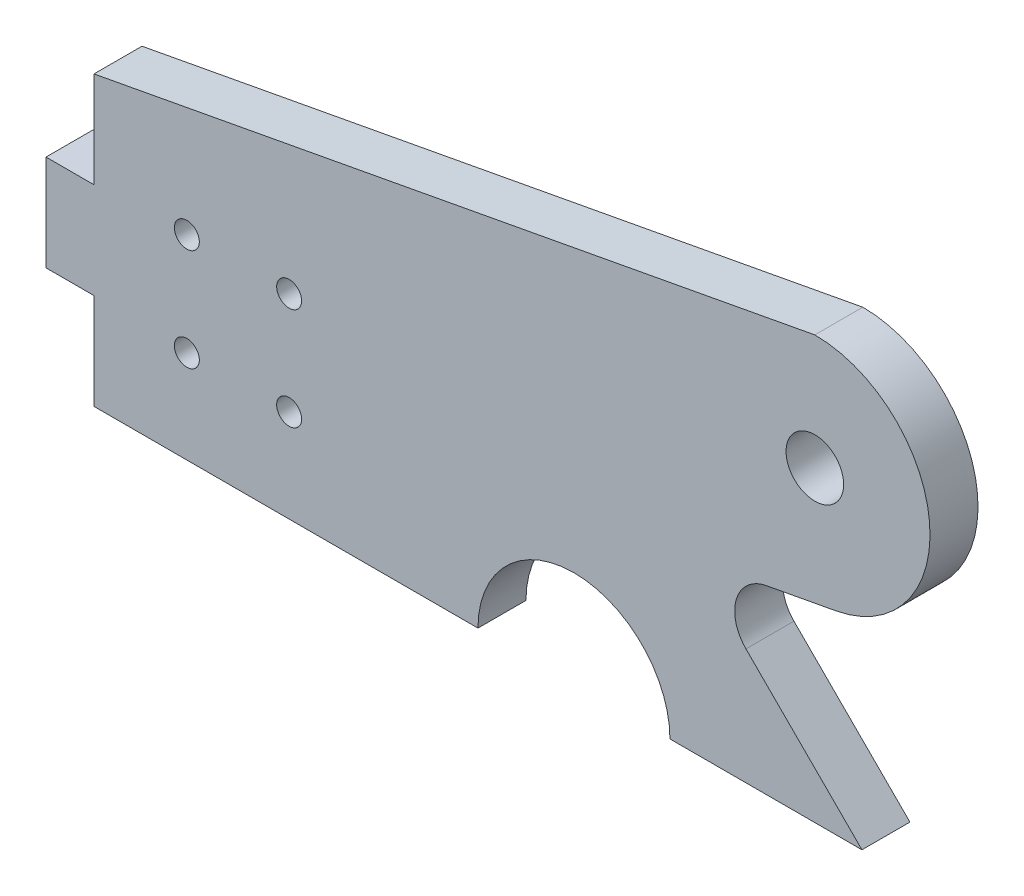
from build123d import *

# Parameters (mm, degrees)
SKETCH1_R           = 3.81
SKETCH1_R_2         = 1.651
BOSS_EXTRUDE1_DEPTH = 6.35
FILLET2_R           = 5.08
SKETCH3_R           = 1.5875
CUT_EXTRUDE1_DEPTH  = 6.35
CUT_EXTRUDE2_DEPTH  = 6.35


with BuildPart() as part:
    # Sketch1 → Boss-Extrude1 (new body)
    with BuildSketch(Plane.XY):
        with BuildLine():
            Line((0, 0), (101.6, 0))
            Line((101.6, 0), (79.43330905, 22.16669095))
            Line((79.43330905, 22.16669095), (98.16062093, 25.658150496))
            ThreePointArc((98.16062093, 25.658150496), (110.542778436, 42.04253584), (95.367453293, 55.88))
            Line((95.367453293, 55.88), (0, 38.1))
            Line((0, 38.1), (0, 25.4))
            Line((0, 25.4), (-6.35, 25.4))
            Line((-6.35, 25.4), (-6.35, 12.7))
            Line((-6.35, 12.7), (0, 12.7))
            Line((0, 12.7), (0, 0))
        make_face()
        with Locations((95.367453293, 40.64)):
            Circle(SKETCH1_R, mode=Mode.SUBTRACT)
        with Locations((25.817011896, 25.817011896)):
            Circle(SKETCH1_R_2, mode=Mode.SUBTRACT)
        with Locations((25.817011896, 12.282988104)):
            Circle(SKETCH1_R_2, mode=Mode.SUBTRACT)
        with Locations((12.282988104, 12.282988104)):
            Circle(SKETCH1_R_2, mode=Mode.SUBTRACT)
        with Locations((12.282988104, 25.817011896)):
            Circle(SKETCH1_R_2, mode=Mode.SUBTRACT)
    extrude(amount=BOSS_EXTRUDE1_DEPTH)

    # Fillet2
    fillet2_edges = [part.edges().sort_by_distance(p)[0] for p in [
        (79.43330905, 22.16669095, 3.175),
    ]]
    fillet(fillet2_edges, radius=FILLET2_R)

    # Sketch3 → Cut-Extrude1 (cut)
    with BuildSketch(Plane.ZY):
        with Locations(Location((3.175, 31.75, 0), (0, 0, 270))):
            Circle(SKETCH3_R)
        with Locations(Location((3.175, 6.35, 0), (0, 0, 270))):
            Circle(SKETCH3_R)
    extrude(amount=-CUT_EXTRUDE1_DEPTH, mode=Mode.SUBTRACT)

    # Sketch6 → Cut-Extrude2 (cut)
    with BuildSketch(Plane.XY.offset(6.35)):
        with BuildLine():
            Line((50.8, 0), (76.2, 0))
            ThreePointArc((76.2, 0), (63.5, 12.7), (50.8, 0))
        make_face()
    extrude(amount=-CUT_EXTRUDE2_DEPTH, mode=Mode.SUBTRACT)


solid = part.part
